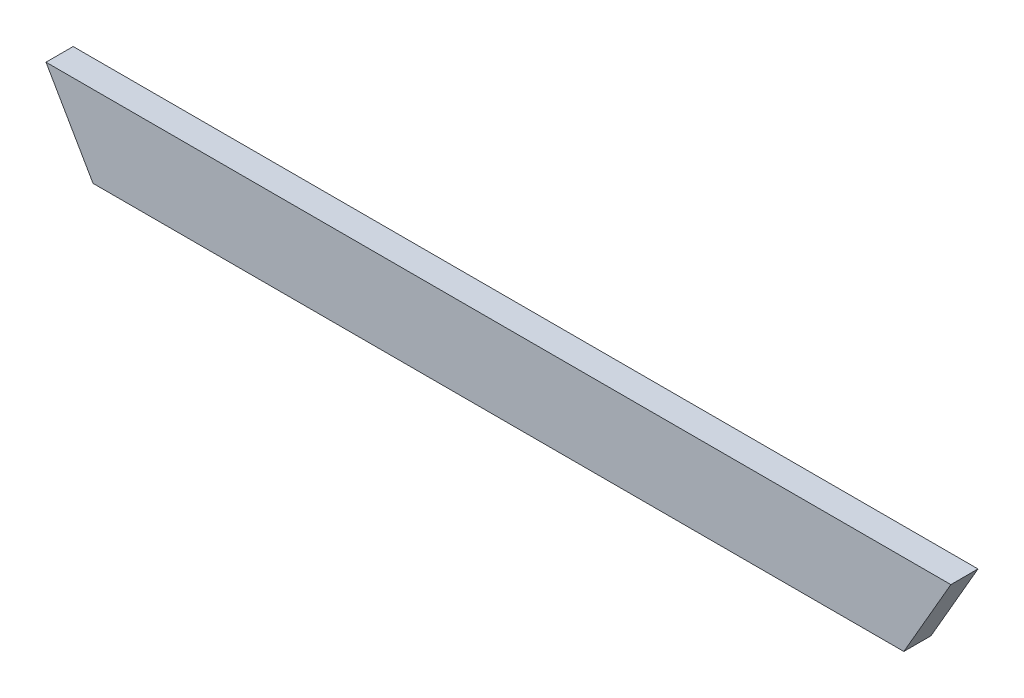
from build123d import *

# Parameters (mm, degrees)
BOSS_EXTRU_1_DEPTH = 15


with BuildPart() as part:
    # Esquisse1 → Boss.-Extru.1 (new body)
    with BuildSketch(Plane.XY):
        Polygon((-225.003085821, 84.109598527), (274.996914179, 84.109598527), (249.016152066, 39.109598527), (-199.022323707, 39.109598527), align=None)
    extrude(amount=BOSS_EXTRU_1_DEPTH)


solid = part.part
